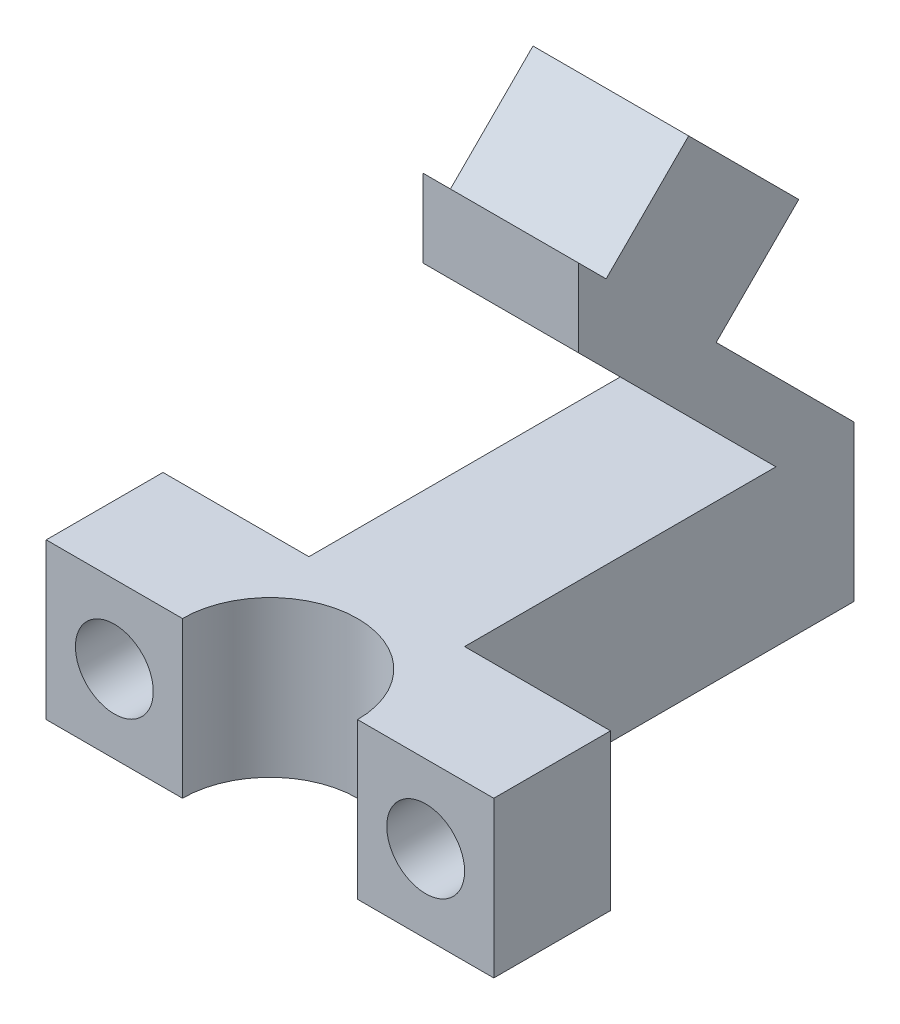
from build123d import *

# Parameters (mm, degrees)
SKETCH2_W           = 115
SKETCH2_H           = 40
BOSS_EXTRUDE1_DEPTH = 60
CUT_EXTRUDE1_DEPTH  = 60
SKETCH4_R           = 10
CUT_EXTRUDE2_DEPTH  = 60
SKETCH5_W           = 40
SKETCH5_H           = 40
BOSS_EXTRUDE2_DEPTH = 100
SKETCH9_W           = 40
SKETCH9_H           = 100
BOSS_EXTRUDE4_DEPTH = 100
CUT_EXTRUDE10_DEPTH = 100
SKETCH12_W          = 40
SKETCH12_H          = 40
BOSS_EXTRUDE6_DEPTH = 30


with BuildPart() as part:
    # Sketch2 → Boss-Extrude1 (new body)
    with BuildSketch(Plane.XY):
        with Locations((-2.12962963, 23.505291005)):
            Rectangle(SKETCH2_W, SKETCH2_H)
    extrude(amount=BOSS_EXTRUDE1_DEPTH)

    # Sketch3 → Cut-Extrude1 (cut)
    with BuildSketch(Plane(origin=(0, 43.505291005, 0), x_dir=(1, 0, 0), z_dir=(0, 1, 0))):
        with BuildLine():
            Line((-59.62962963, -30), (-24.62962963, -30))
            ThreePointArc((-24.62962963, -30), (-2.12962963, -7.5), (20.37037037, -30))
            Line((20.37037037, -30), (55.37037037, -30))
            Line((55.37037037, -30), (55.37037037, -60))
            Line((55.37037037, -60), (-59.62962963, -60))
            Line((-59.62962963, -60), (-59.62962963, -30))
        make_face()
    extrude(amount=-CUT_EXTRUDE1_DEPTH, mode=Mode.SUBTRACT)

    # Sketch4 → Cut-Extrude2 (cut)
    with BuildSketch(Plane.XY.offset(30)):
        with Locations((-42.12962963, 23.505291005)):
            Circle(SKETCH4_R)
        with Locations((37.87037037, 23.505291005)):
            Circle(SKETCH4_R)
    extrude(amount=-CUT_EXTRUDE2_DEPTH, mode=Mode.SUBTRACT)

    # Sketch5 → Boss-Extrude2 (add)
    with BuildSketch(Plane(origin=(0, 0, 0), x_dir=(-1, 0, 0), z_dir=(0, 0, -1))):
        with Locations((2.12962963, 23.505291005)):
            Rectangle(SKETCH5_W, SKETCH5_H)
    extrude(amount=BOSS_EXTRUDE2_DEPTH)

    # Sketch9 → Boss-Extrude4 (add)
    with BuildSketch(Plane(origin=(0, 43.505291005, 0), x_dir=(1, 0, 0), z_dir=(0, 1, 0))):
        with Locations((-2.12962963, 50)):
            Rectangle(SKETCH9_W, SKETCH9_H)
    extrude(amount=BOSS_EXTRUDE4_DEPTH)

    # Sketch10 → Cut-Extrude10 (cut)
    with BuildSketch(Plane(origin=(17.87037037, 0, 0), x_dir=(0, 0, -1), z_dir=(1, 0, 0))):
        Polygon((100, 43.505291005), (29.289321881, 114.215969124), (29.289321881, 94.215969124), (80, 43.505291005), (0, 43.505291005), (0, 143.505291005), (100, 143.505291005), align=None)
    extrude(amount=-CUT_EXTRUDE10_DEPTH, mode=Mode.SUBTRACT)

    # Sketch12 → Boss-Extrude6 (add)
    with BuildSketch(Plane(origin=(0, 71.752645503, -71.752645503), x_dir=(1, 0, 0), z_dir=(0, 0.7071067811865513, -0.7071067811865438))):
        with Locations((-2.12962963, -30.052208169)):
            Rectangle(SKETCH12_W, SKETCH12_H)
    extrude(amount=BOSS_EXTRUDE6_DEPTH)


solid = part.part
